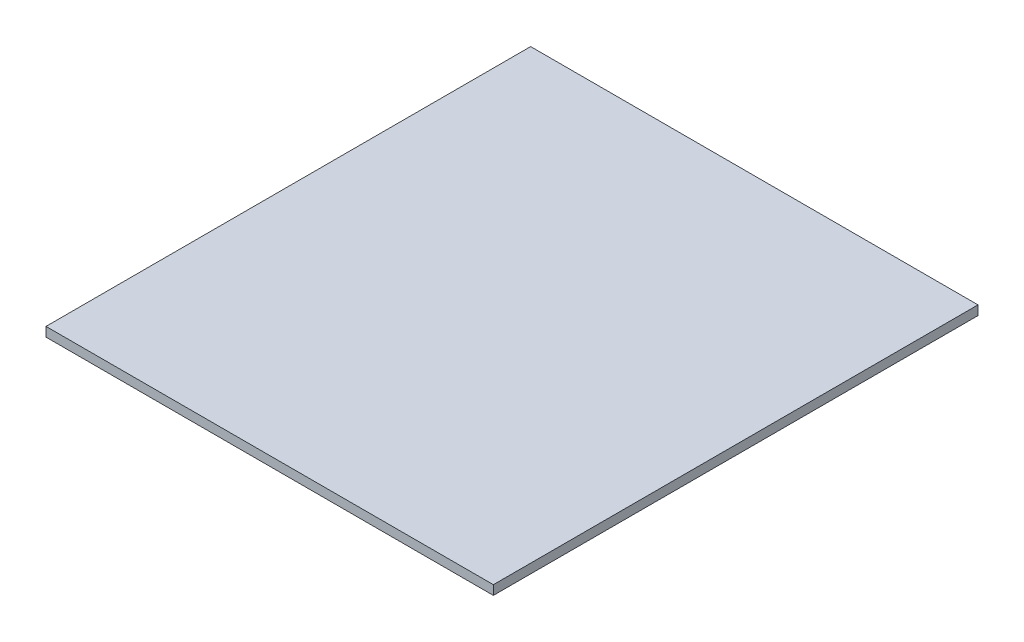
from build123d import *

# Parameters (mm, degrees)
SKETCH1_W           = 304.8
SKETCH1_H           = 330.2
BOSS_EXTRUDE1_DEPTH = 6.35


with BuildPart() as part:
    # Sketch1 → Boss-Extrude1 (new body)
    with BuildSketch(Plane(origin=(0, 0, 0), x_dir=(1, 0, 0), z_dir=(0, 1, 0))):
        Rectangle(SKETCH1_W, SKETCH1_H)
    extrude(amount=BOSS_EXTRUDE1_DEPTH)


solid = part.part
